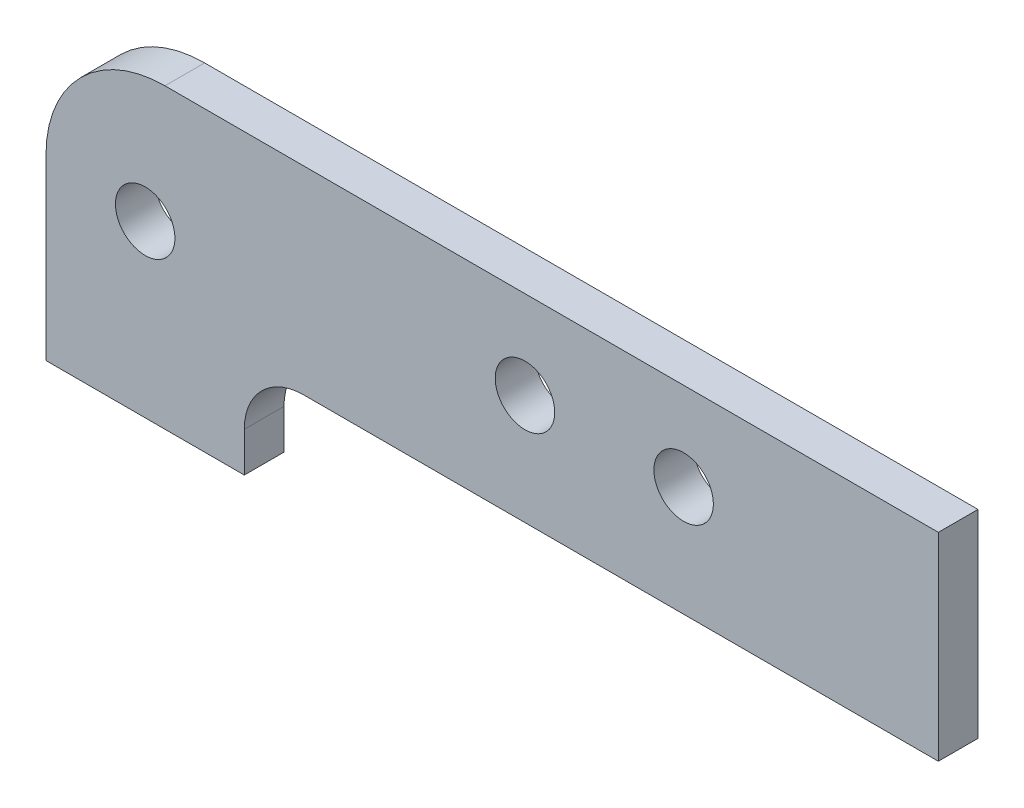
from build123d import *

# Parameters (mm, degrees)
EXTRUDE_1_DEPTH = 2
HOLE_WIZARD_1_D = 3
HOLE_WIZARD_2_D = 3


with BuildPart() as part:
    # 草图1 → 凸台-拉伸1 (new body)
    with BuildSketch(Plane.XY):
        with BuildLine():
            Line((17.5, 5), (-17.5, 5))
            Line((-17.5, 5), (-21.5, 5))
            ThreePointArc((-21.5, 5), (-25.742640687, 3.242640687), (-27.5, -1))
            Line((-27.5, -1), (-27.5, -10))
            Line((-27.5, -10), (-17.5, -10))
            Line((-17.5, -10), (-17.5, -8))
            ThreePointArc((-17.5, -8), (-16.621320344, -5.878679656), (-14.5, -5))
            Line((-14.5, -5), (17.5, -5))
            Line((17.5, -5), (17.5, 5))
        make_face()
    extrude(amount=EXTRUDE_1_DEPTH)

    # 孔1 (through all)
    with Locations(Plane.XY.offset(2)):
        with Locations((-22.498361417, -1.410422078)):
            Hole(HOLE_WIZARD_1_D / 2)

    # 孔2 (through all)
    with Locations(Plane.XY.offset(2)):
        with Locations((4.655, 0.556399926), (-3.345, 0.556399926)):
            Hole(HOLE_WIZARD_2_D / 2)


solid = part.part
